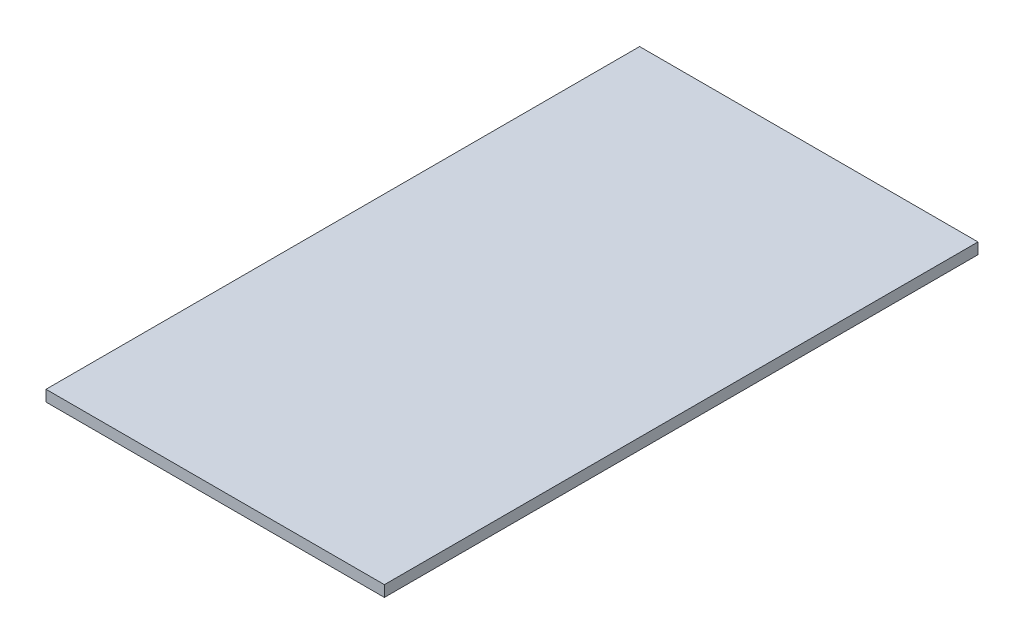
from build123d import *

# Parameters (mm, degrees)
ESQUISSE1_W        = 61
ESQUISSE1_H        = 107
BOSS_EXTRU_1_DEPTH = 2


with BuildPart() as part:
    # Esquisse1 → Boss.-Extru.1 (new body)
    with BuildSketch(Plane(origin=(0, 0, 0), x_dir=(1, 0, 0), z_dir=(0, 1, 0))):
        Rectangle(ESQUISSE1_W, ESQUISSE1_H)
    extrude(amount=BOSS_EXTRU_1_DEPTH)


solid = part.part
